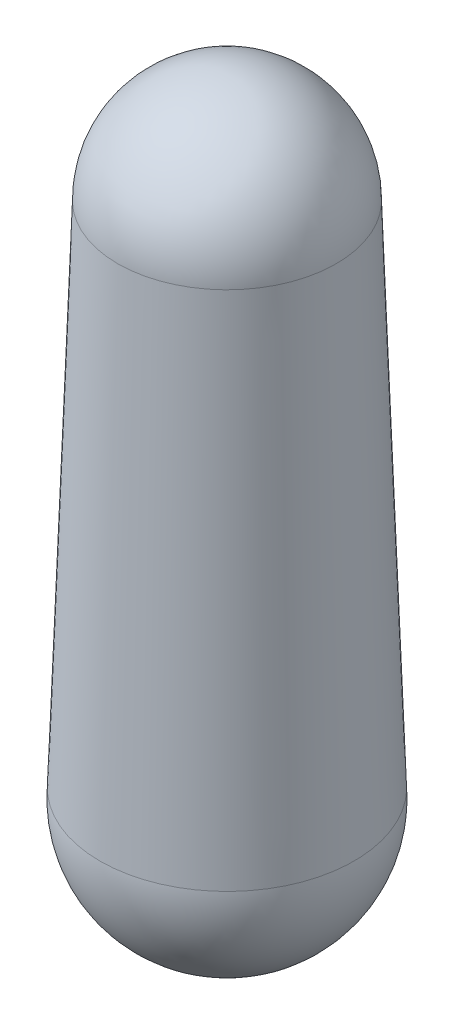
from build123d import *

# Parameters (mm, degrees)
SKETCH2_R           = 1.97
BOSS_EXTRUDE1_DEPTH = 8
BOSS_EXTRUDE1_TAPER = 2


with BuildPart() as part:
    # Sketch1 → Revolve1 (revolve)
    with BuildSketch(Plane(origin=(0, 0, 0), x_dir=(1, 0, 0), z_dir=(0, 1, 0))):
        with BuildLine():
            Line((0, 1.97), (0, -1.97))
            ThreePointArc((0, -1.97), (1.97, 0), (0, 1.97))
        make_face()
    revolve(axis=Axis((0, 0, -1.97), (0, 0, 1)))

    # Sketch2 → Boss-Extrude1 (add)
    with BuildSketch(Plane(origin=(0, 0, 0), x_dir=(1, 0, 0), z_dir=(0, 1, 0))):
        Circle(SKETCH2_R)
    extrude(amount=BOSS_EXTRUDE1_DEPTH, taper=BOSS_EXTRUDE1_TAPER)

    # Sketch3 → Revolve2 (revolve)
    with BuildSketch(Plane(origin=(0, 8, 0), x_dir=(1, 0, 0), z_dir=(0, 1, 0))):
        with BuildLine():
            Line((0, 1.690633844), (0, -1.690633844))
            ThreePointArc((0, -1.690633844), (1.690633844, 0), (0, 1.690633844))
        make_face()
    revolve(axis=Axis((0, 8, -1.690633844), (0, 0, 1)))


solid = part.part
